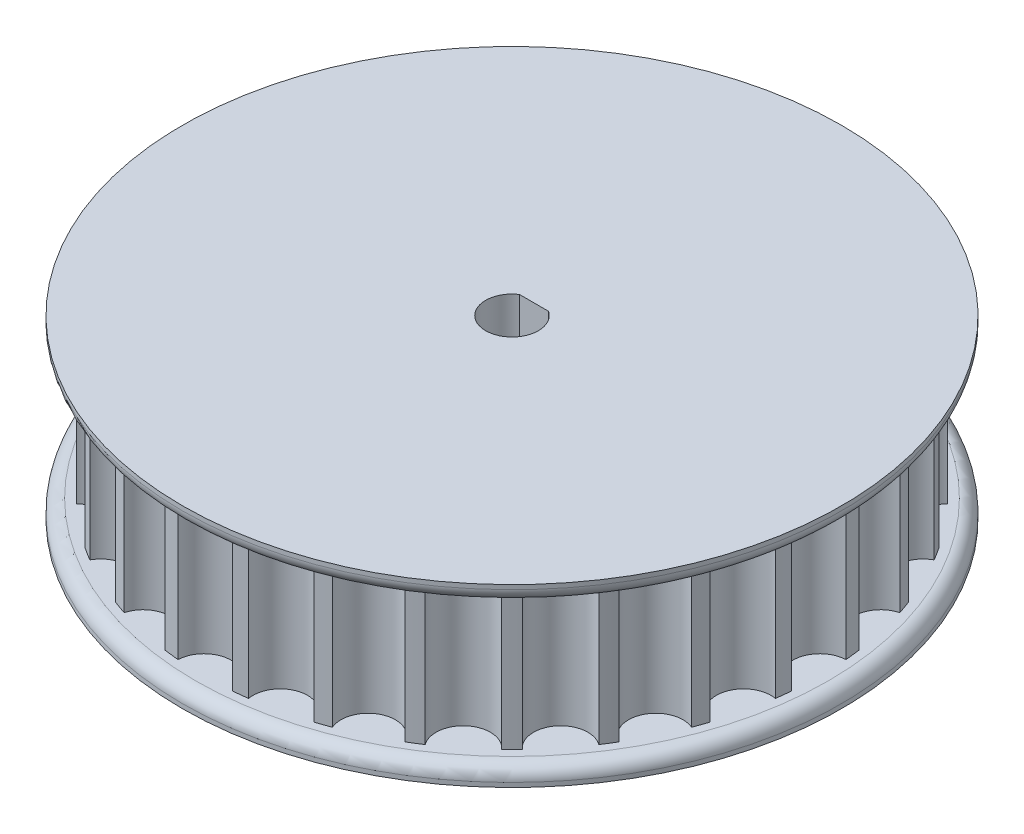
from build123d import *

# Parameters (mm, degrees)
BOSS_EXTRUDE1_DEPTH  = 8
BOSS_EXTRUDE2_START  = 2
SKETCH2_R            = 37.5
BOSS_EXTRUDE2_DEPTH  = 2
FILLET1_R            = 1.5
FILLET1_OF_MIRROR1_R = 1.5
SKETCH3_R            = 1.6
CUT_EXTRUDE1_DEPTH   = 54.967582932
CUT_EXTRUDE2_START   = -10
SKETCH3_3_R          = 1.6
CUT_EXTRUDE2_DEPTH   = 4.1
SKETCH4_W            = 5.5
SKETCH4_H            = 4.1
CUT_EXTRUDE3_DEPTH   = 10
CUT_EXTRUDE4_START   = -5
SKETCH5_R            = 2.9
CUT_EXTRUDE4_DEPTH   = 60.566322571


with BuildPart() as part:
    # Sketch1 → Boss-Extrude1 (new, symmetric)
    with BuildSketch(Plane(origin=(0, 0, 0), x_dir=(1, 0, 0), z_dir=(0, 1, 0))):
        with BuildLine():
            ThreePointArc((3.096965553, 34.902871005), (0, 31.94), (-3.096965553, 34.902871005))
            ThreePointArc((-3.096965553, 34.902871005), (-3.923235243, 34.819675835), (-4.747301293, 34.716922825))
            ThreePointArc((-4.747301293, 34.716922825), (-7.107318631, 31.139197515), (-10.785937615, 33.33864349))
            ThreePointArc((-10.785937615, 33.33864349), (-11.572978331, 33.073671894), (-12.353518629, 32.79012317))
            ThreePointArc((-12.353518629, 32.79012317), (-13.858246627, 28.776945641), (-17.934057726, 30.102677181))
            ThreePointArc((-17.934057726, 30.102677181), (-18.642403961, 29.669215941), (-19.340278957, 29.219089819))
            ThreePointArc((-19.340278957, 29.219089819), (-19.914264271, 24.97169755), (-24.182889297, 25.357236941))
            ThreePointArc((-24.182889297, 25.357236941), (-24.777021613, 24.777021613), (-25.357236941, 24.182889297))
            ThreePointArc((-25.357236941, 24.182889297), (-24.97169755, 19.914264271), (-29.219089819, 19.340278957))
            ThreePointArc((-29.219089819, 19.340278957), (-29.669215941, 18.642403961), (-30.102677181, 17.934057726))
            ThreePointArc((-30.102677181, 17.934057726), (-28.776945641, 13.858246627), (-32.79012317, 12.353518629))
            ThreePointArc((-32.79012317, 12.353518629), (-33.073671894, 11.572978331), (-33.33864349, 10.785937615))
            ThreePointArc((-33.33864349, 10.785937615), (-31.139197515, 7.107318631), (-34.716922825, 4.747301293))
            ThreePointArc((-34.716922825, 4.747301293), (-34.819675835, 3.923235243), (-34.902871005, 3.096965553))
            ThreePointArc((-34.902871005, 3.096965553), (-31.94, 0), (-34.902871005, -3.096965553))
            ThreePointArc((-34.902871005, -3.096965553), (-34.819675835, -3.923235243), (-34.716922825, -4.747301293))
            ThreePointArc((-34.716922825, -4.747301293), (-31.139197515, -7.107318631), (-33.33864349, -10.785937615))
            ThreePointArc((-33.33864349, -10.785937615), (-33.073671894, -11.572978331), (-32.79012317, -12.353518629))
            ThreePointArc((-32.79012317, -12.353518629), (-28.776945641, -13.858246627), (-30.102677181, -17.934057726))
            ThreePointArc((-30.102677181, -17.934057726), (-29.669215941, -18.642403961), (-29.219089819, -19.340278957))
            ThreePointArc((-29.219089819, -19.340278957), (-24.97169755, -19.914264271), (-25.357236941, -24.182889297))
            ThreePointArc((-25.357236941, -24.182889297), (-24.777021613, -24.777021613), (-24.182889297, -25.357236941))
            ThreePointArc((-24.182889297, -25.357236941), (-19.914264271, -24.97169755), (-19.340278957, -29.219089819))
            ThreePointArc((-19.340278957, -29.219089819), (-18.642403961, -29.669215941), (-17.934057726, -30.102677181))
            ThreePointArc((-17.934057726, -30.102677181), (-13.858246627, -28.776945641), (-12.353518629, -32.79012317))
            ThreePointArc((-12.353518629, -32.79012317), (-11.572978331, -33.073671894), (-10.785937615, -33.33864349))
            ThreePointArc((-10.785937615, -33.33864349), (-7.107318631, -31.139197515), (-4.747301293, -34.716922825))
            ThreePointArc((-4.747301293, -34.716922825), (-3.923235243, -34.819675835), (-3.096965553, -34.902871005))
            ThreePointArc((-3.096965553, -34.902871005), (0, -31.94), (3.096965553, -34.902871005))
            ThreePointArc((3.096965553, -34.902871005), (3.923235243, -34.819675835), (4.747301293, -34.716922825))
            ThreePointArc((4.747301293, -34.716922825), (7.107318631, -31.139197515), (10.785937615, -33.33864349))
            ThreePointArc((10.785937615, -33.33864349), (11.572978331, -33.073671894), (12.353518629, -32.79012317))
            ThreePointArc((12.353518629, -32.79012317), (13.858246627, -28.776945641), (17.934057726, -30.102677181))
            ThreePointArc((17.934057726, -30.102677181), (18.642403961, -29.669215941), (19.340278957, -29.219089819))
            ThreePointArc((19.340278957, -29.219089819), (19.914264271, -24.97169755), (24.182889297, -25.357236941))
            ThreePointArc((24.182889297, -25.357236941), (24.777021613, -24.777021613), (25.357236941, -24.182889297))
            ThreePointArc((25.357236941, -24.182889297), (24.97169755, -19.914264271), (29.219089819, -19.340278957))
            ThreePointArc((29.219089819, -19.340278957), (29.669215941, -18.642403961), (30.102677181, -17.934057726))
            ThreePointArc((30.102677181, -17.934057726), (28.776945641, -13.858246627), (32.79012317, -12.353518629))
            ThreePointArc((32.79012317, -12.353518629), (33.073671894, -11.572978331), (33.33864349, -10.785937615))
            ThreePointArc((33.33864349, -10.785937615), (31.139197515, -7.107318631), (34.716922825, -4.747301293))
            ThreePointArc((34.716922825, -4.747301293), (34.819675835, -3.923235243), (34.902871005, -3.096965553))
            ThreePointArc((34.902871005, -3.096965553), (31.94, 0), (34.902871005, 3.096965553))
            ThreePointArc((34.902871005, 3.096965553), (34.819675835, 3.923235243), (34.716922825, 4.747301293))
            ThreePointArc((34.716922825, 4.747301293), (31.139197515, 7.107318631), (33.33864349, 10.785937615))
            ThreePointArc((33.33864349, 10.785937615), (33.073671894, 11.572978331), (32.79012317, 12.353518629))
            ThreePointArc((32.79012317, 12.353518629), (28.776945641, 13.858246627), (30.102677181, 17.934057726))
            ThreePointArc((30.102677181, 17.934057726), (29.669215941, 18.642403961), (29.219089819, 19.340278957))
            ThreePointArc((29.219089819, 19.340278957), (24.97169755, 19.914264271), (25.357236941, 24.182889297))
            ThreePointArc((25.357236941, 24.182889297), (24.777021613, 24.777021613), (24.182889297, 25.357236941))
            ThreePointArc((24.182889297, 25.357236941), (19.914264271, 24.97169755), (19.340278957, 29.219089819))
            ThreePointArc((19.340278957, 29.219089819), (18.642403961, 29.669215941), (17.934057726, 30.102677181))
            ThreePointArc((17.934057726, 30.102677181), (13.858246627, 28.776945641), (12.353518629, 32.79012317))
            ThreePointArc((12.353518629, 32.79012317), (11.572978331, 33.073671894), (10.785937615, 33.33864349))
            ThreePointArc((10.785937615, 33.33864349), (7.107318631, 31.139197515), (4.747301293, 34.716922825))
            ThreePointArc((4.747301293, 34.716922825), (3.923235243, 34.819675835), (3.096965553, 34.902871005))
        make_face()
        with BuildLine():
            ThreePointArc((1.658312395, 2.5), (0, -3), (-1.658312395, 2.5))
            Line((-1.658312395, 2.5), (1.658312395, 2.5))
        make_face(mode=Mode.SUBTRACT)
    extrude(amount=BOSS_EXTRUDE1_DEPTH, both=True)

    # Sketch2 → Boss-Extrude2 (add)
    with BuildSketch(Plane(origin=(0, 8, 0), x_dir=(1, 0, 0), z_dir=(0, 1, 0)).offset(BOSS_EXTRUDE2_START)):
        Circle(SKETCH2_R)
        with BuildLine():
            Line((-1.658312395, 2.5), (1.658312395, 2.5))
            ThreePointArc((1.658312395, 2.5), (0, -3), (-1.658312395, 2.5))
        make_face(mode=Mode.SUBTRACT)
    boss_extrude2 = extrude(amount=-BOSS_EXTRUDE2_DEPTH)

    # Fillet1
    fillet1_edges = [part.edges().sort_by_distance(p)[0] for p in [
        (-37.5, 8, 0),
    ]]
    fillet(fillet1_edges, radius=FILLET1_R)

    # Mirror1: Boss-Extrude2 across plane
    add(boss_extrude2.mirror(Plane.ZX))

    # Fillet1 of Mirror1
    fillet1_of_mirror1_edges = [part.edges().sort_by_distance(p)[0] for p in [
        (-37.5, -8, 0),
    ]]
    fillet(fillet1_of_mirror1_edges, radius=FILLET1_OF_MIRROR1_R)

    # Sketch3 → Cut-Extrude1 (cut, through all)
    with BuildSketch(Plane.XY):
        Circle(SKETCH3_R)
    extrude(amount=-CUT_EXTRUDE1_DEPTH, mode=Mode.SUBTRACT)

    # Sketch3<3> → Cut-Extrude2 (cut)
    with BuildSketch(Plane.XY.offset(CUT_EXTRUDE2_START)):
        Polygon((0, -3.175426481), (2.75, -1.58771324), (2.75, 1.58771324), (0, 3.175426481), (-2.75, 1.58771324), (-2.75, -1.58771324), align=None)
        Circle(SKETCH3_3_R, mode=Mode.SUBTRACT)
    extrude(amount=-CUT_EXTRUDE2_DEPTH, mode=Mode.SUBTRACT)

    # Sketch4 → Cut-Extrude3 (cut)
    with BuildSketch(Plane(origin=(0, -10, 0), x_dir=(-1, 0, 0), z_dir=(0, -1, 0))):
        with Locations((0, 12.05)):
            Rectangle(SKETCH4_W, SKETCH4_H)
    extrude(amount=-CUT_EXTRUDE3_DEPTH, mode=Mode.SUBTRACT)

    # Sketch5 → Cut-Extrude4 (cut, through all)
    with BuildSketch(Plane.XY.offset(-14.1).offset(CUT_EXTRUDE4_START)):
        Circle(SKETCH5_R)
    extrude(amount=-CUT_EXTRUDE4_DEPTH, mode=Mode.SUBTRACT)


solid = part.part
